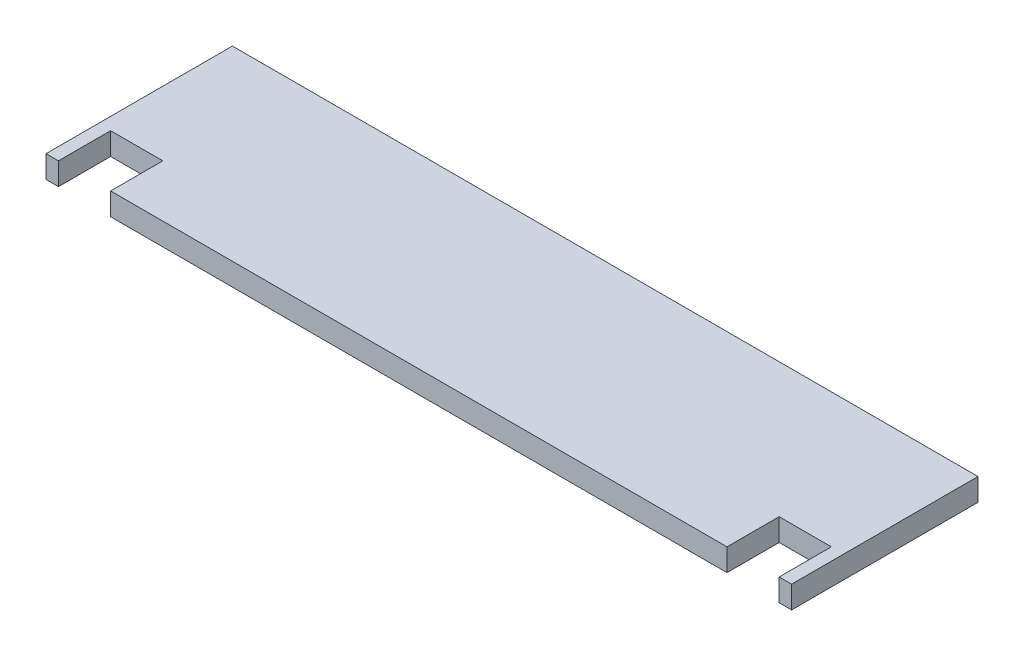
from build123d import *

# Parameters (mm, degrees)
ESQUISSE1_W             = 600
ESQUISSE1_H             = 150
BOSS_EXTRU_1_DEPTH      = 18
ESQUISSE3_W             = 42
ESQUISSE3_H             = 42
ENL_V_MAT_EXTRU_1_DEPTH = 20


with BuildPart() as part:
    # Esquisse1 → Boss.-Extru.1 (new body)
    with BuildSketch(Plane(origin=(0, 0, 0), x_dir=(1, 0, 0), z_dir=(0, 1, 0))):
        Rectangle(ESQUISSE1_W, ESQUISSE1_H)
    extrude(amount=BOSS_EXTRU_1_DEPTH)

    # Esquisse3 → Enlèv. mat.-Extru.1 (cut)
    with BuildSketch(Plane(origin=(0, 18, 0), x_dir=(1, 0, 0), z_dir=(0, 1, 0))):
        with Locations((-269, -54)):
            Rectangle(ESQUISSE3_W, ESQUISSE3_H)
        with Locations((269, -54)):
            Rectangle(ESQUISSE3_W, ESQUISSE3_H)
    extrude(amount=-ENL_V_MAT_EXTRU_1_DEPTH, mode=Mode.SUBTRACT)


solid = part.part
